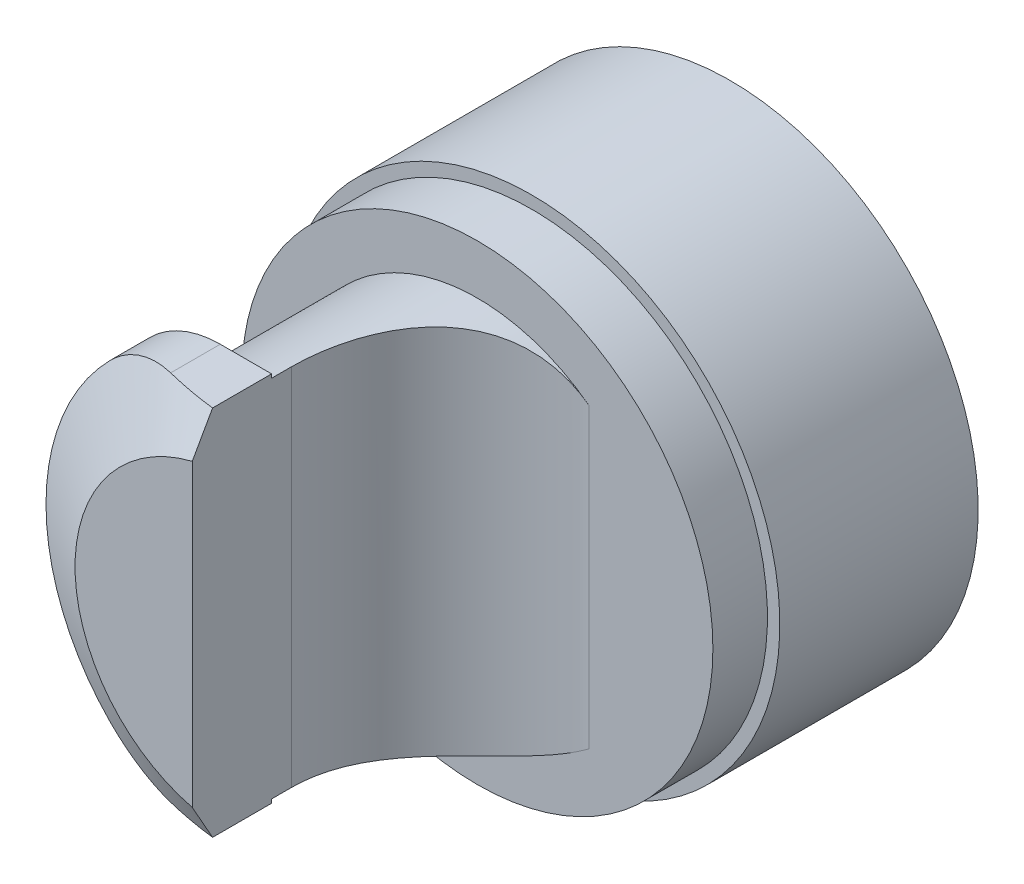
from build123d import *
from OCP.BRepFilletAPI import BRepFilletAPI_MakeChamfer

# Parameters (mm, degrees)
SKETCH1_R               = 2.375
BOSS_EXTRUDE1_DEPTH     = 0.55
SKETCH2_R               = 1.875
BOSS_EXTRUDE2_DEPTH     = 1.7
SKETCH3_R               = 2.5
BOSS_EXTRUDE3_DEPTH     = 2
SKETCH4_R               = 2.25
BOSS_EXTRUDE4_DEPTH     = 0.8
CUT_EXTRUDE1_REACH      = 8.165
SKETCH5_W               = 0.75
SKETCH5_H               = 6.07376998
CHAMFER1_SIZE           = 0.4
CHAMFER1_SIZE2          = 0.692820323
SKETCH6_W               = 6.999273813
SKETCH6_H               = 5.334981493
SKETCH6_W_2             = 6.558585844
SKETCH6_H_2             = 3.75
CUT_EXTRUDE3_DEPTH      = 2
FILLET2_R               = 1
SKETCH7_R               = 1
CUT_EXTRUDE4_DEPTH      = 2
CUT_EXTRUDE5_DEPTH      = 3
CUT_EXTRUDE5_DEPTH_BACK = 10
SKETCH9_W               = 3.309409713
SKETCH9_H               = 2.920914296
FILLET3_R               = 1.5


with BuildPart() as part:
    # Sketch1 → Boss-Extrude1 (new body)
    with BuildSketch(Plane.XY):
        Circle(SKETCH1_R)
    extrude(amount=BOSS_EXTRUDE1_DEPTH)

    # Sketch2 → Boss-Extrude2 (add)
    with BuildSketch(Plane.XY.offset(0.55)):
        Circle(SKETCH2_R)
    extrude(amount=BOSS_EXTRUDE2_DEPTH)

    # Sketch3 → Boss-Extrude3 (add)
    with BuildSketch(Plane(origin=(0, 0, 0), x_dir=(-1, 0, 0), z_dir=(0, 0, -1))):
        Circle(SKETCH3_R)
    extrude(amount=BOSS_EXTRUDE3_DEPTH)

    # Sketch4 → Boss-Extrude4 (add)
    with BuildSketch(Plane.XY.offset(2.25)):
        Circle(SKETCH4_R)
    extrude(amount=BOSS_EXTRUDE4_DEPTH)

    # Cut-Extrude1: up to this face of the body (flat: up to its plane)
    cut_extrude1_end = Plane(part.part.faces().sort_by_distance((-2.307824856, 0, 0.55))[0])
    # Sketch5 → Cut-Extrude1 (cut, up to the picked face)
    with BuildSketch(Plane.XY.offset(3.05), mode=Mode.PRIVATE) as cut_extrude1_sk1:
        Rectangle(SKETCH5_W, SKETCH5_H)
    cut_extrude1_tool1 = split(extrude(cut_extrude1_sk1.sketch, amount=-CUT_EXTRUDE1_REACH, mode=Mode.PRIVATE), bisect_by=cut_extrude1_end, keep=Keep.BOTH, mode=Mode.PRIVATE)
    add(cut_extrude1_tool1.solids().sort_by(Axis((0, 0, 3.05), (0, 0, -1)))[0], mode=Mode.SUBTRACT)

    # Chamfer1: one chamfer whose edges measure the first distance from different faces: ONE call of the kernel's chamfer builder (chamfer() names one face for all edges)
    chamfer1_edges_1 = [part.edges().sort_by_distance(p)[0] for p in [
        (-2.25, 0, 3.05),
    ]]
    chamfer1_side_1 = [part.faces().sort_by_distance(p)[0] for p in [
        (-2.25, 0, 2.65),
    ]]
    chamfer1_edges_2 = [part.edges().sort_by_distance(p)[0] for p in [
        (2.25, 0, 3.05),
    ]]
    chamfer1_side_2 = [part.faces().sort_by_distance(p)[0] for p in [
        (2.25, 0, 2.65),
    ]]
    chamfer1 = BRepFilletAPI_MakeChamfer(part.part.solid().wrapped)
    for e in chamfer1_edges_1:
        chamfer1.Add(CHAMFER1_SIZE, CHAMFER1_SIZE2, e.wrapped, chamfer1_side_1[0].wrapped)  # the first distance lies on this face
    for e in chamfer1_edges_2:
        chamfer1.Add(CHAMFER1_SIZE, CHAMFER1_SIZE2, e.wrapped, chamfer1_side_2[0].wrapped)  # the first distance lies on this face
    add(Compound.cast(chamfer1.Shape()), mode=Mode.REPLACE)

    # Sketch6 → Cut-Extrude3 (cut)
    with BuildSketch(Plane.XY.offset(3.05)):
        with Locations((0.047792, -0.043471688)):
            Rectangle(SKETCH6_W, SKETCH6_H)
        Rectangle(SKETCH6_W_2, SKETCH6_H_2, mode=Mode.SUBTRACT)
    extrude(amount=-CUT_EXTRUDE3_DEPTH, mode=Mode.SUBTRACT)

    # Fillet2
    fillet2_edges = [part.edges().sort_by_distance(p)[0] for p in [
        (-1.243734296, 1.875, 2.45),
        (1.243734296, 1.875, 2.45),
        (-1.243734296, -1.875, 2.45),
        (1.243734296, -1.875, 2.45),
    ]]
    fillet(fillet2_edges, radius=FILLET2_R)

    # Sketch7 → Cut-Extrude4 (cut)
    with BuildSketch(Plane(origin=(0, 0, -2), x_dir=(-1, 0, 0), z_dir=(0, 0, -1))):
        Circle(SKETCH7_R)
    extrude(amount=-CUT_EXTRUDE4_DEPTH, mode=Mode.SUBTRACT)

    # Sketch9 → Cut-Extrude5 (cut, two sides: drawn at the far end of the back side and taken through both)
    with BuildSketch(Plane(origin=(0, 0, 0), x_dir=(1, 0, 0), z_dir=(0, 1, 0)).offset(-CUT_EXTRUDE5_DEPTH_BACK)):
        with Locations((1.654704857, -2.010457148)):
            Rectangle(SKETCH9_W, SKETCH9_H)
    extrude(amount=CUT_EXTRUDE5_DEPTH + CUT_EXTRUDE5_DEPTH_BACK, mode=Mode.SUBTRACT)

    # Fillet3
    fillet3_edges = [part.edges().sort_by_distance(p)[0] for p in [
        (-0.375, 0, 0.55),
    ]]
    fillet(fillet3_edges, radius=FILLET3_R)


solid = part.part
